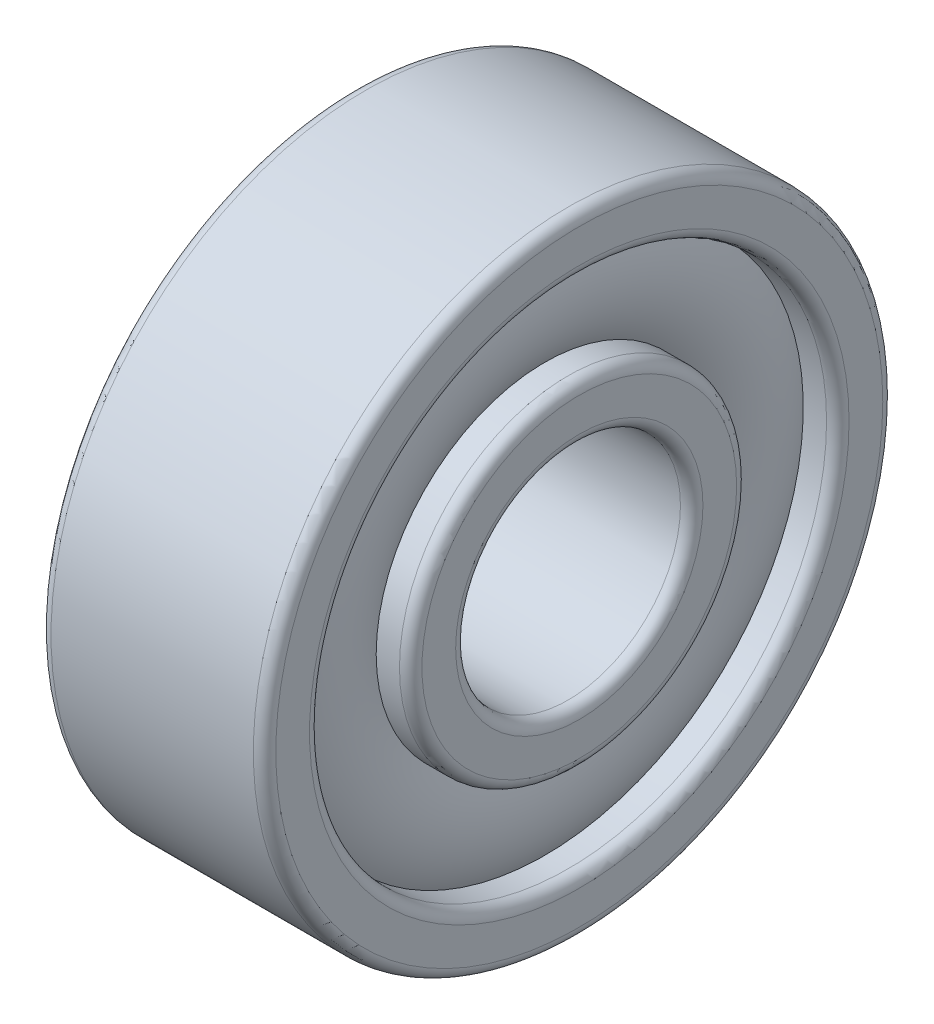
from build123d import *

# Parameters (mm, degrees)
SKETCH_2_R          = 2.5
CUT_EXTRUDE_1_DEPTH = 5
FILLET_1_R          = 0.25


with BuildPart() as part:
    # 草图1 → 旋转1 (revolve)
    with BuildSketch(Plane.XY, mode=Mode.PRIVATE) as revolve_1_sk:
        with BuildLine():
            Line((2.5, 2.5), (2.5, 3.75))
            Line((2.5, 3.75), (1.732050808, 3.75))
            ThreePointArc((1.732050808, 3.75), (2, 4.75), (1.732050808, 5.75))
            Line((1.732050808, 5.75), (2.5, 5.75))
            Line((2.5, 5.75), (2.5, 7))
            Line((2.5, 7), (-2.5, 7))
            Line((-2.5, 7), (-2.5, 5.75))
            Line((-2.5, 5.75), (-1.732050808, 5.75))
            ThreePointArc((-1.732050808, 5.75), (-2, 4.75), (-1.732050808, 3.75))
            Line((-1.732050808, 3.75), (-2.5, 3.75))
            Line((-2.5, 3.75), (-2.5, 2.5))
            Line((-2.5, 2.5), (-2.5, 0))
            Line((-2.5, 0), (2.5, 0))
            Line((2.5, 0), (2.5, 2.5))
        make_face()
    revolve(revolve_1_sk.sketch.rotate(Axis((-5.578389838, 0, 0), (1, 0, 0)), 90), axis=Axis((-5.578389838, 0, 0), (1, 0, 0)))

    # 草图2 → 切除-拉伸1 (cut)
    with BuildSketch(Plane.ZY.offset(2.5)):
        Circle(SKETCH_2_R)
    extrude(amount=-CUT_EXTRUDE_1_DEPTH, mode=Mode.SUBTRACT)

    # 圆角1
    fillet_1_edges = [part.edges().sort_by_distance(p)[0] for p in [
        (2.5, 0, -3.75),
        (-2.5, 0, -3.75),
        (-2.5, 0, -5.75),
        (-2.5, 0, -7),
        (2.5, 0, -7),
        (2.5, 0, -5.75),
        (2.5, 0, -2.5),
        (-2.5, 0, -2.5),
    ]]
    fillet(fillet_1_edges, radius=FILLET_1_R)


solid = part.part
